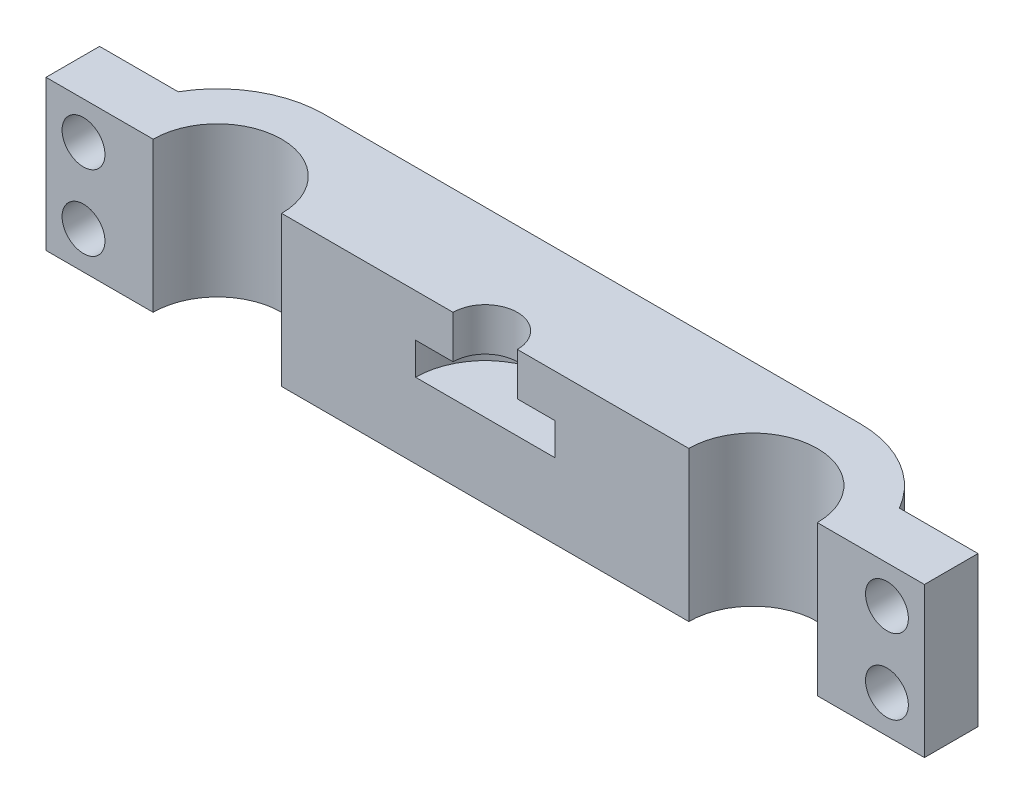
from build123d import *

# Parameters (mm, degrees)
BOSS_EXTRUDE1_DEPTH     = 14
CUT_EXTRUDE1_DEPTH      = 45.463468151
CUT_EXTRUDE1_DEPTH_BACK = 45.463468151
SKETCH4_R               = 2
SKETCH5_W               = 9.30871577
SKETCH5_H               = 4.044371358
BOSS_EXTRUDE2_DEPTH     = 7
CUT_EXTRUDE2_START      = 1.5
SKETCH6_R               = 6.5
CUT_EXTRUDE2_DEPTH      = 1.5


with BuildPart() as part:
    # Sketch2 → Boss-Extrude1 (new body)
    with BuildSketch(Plane(origin=(0, 0, 0), x_dir=(1, 0, 0), z_dir=(0, 1, 0))):
        with BuildLine():
            Line((-3, 0), (-19, 0))
            ThreePointArc((-19, 0), (-25, 6), (-31, 0))
            Line((-31, 0), (-41, 0))
            Line((-41, 0), (-41, 5))
            Line((-41, 5), (-33.660254038, 5))
            ThreePointArc((-33.660254038, 5), (-30, 8.660254038), (-25, 10))
            Line((-25, 10), (25, 10))
            ThreePointArc((25, 10), (30, 8.660254038), (33.660254038, 5))
            Line((33.660254038, 5), (41, 5))
            Line((41, 5), (41, 0))
            Line((41, 0), (31, 0))
            ThreePointArc((31, 0), (25, 6), (19, 0))
            Line((19, 0), (3, 0))
            ThreePointArc((3, 0), (0, 3), (-3, 0))
        make_face()
    extrude(amount=BOSS_EXTRUDE1_DEPTH)

    # Sketch4 → Cut-Extrude1 (cut, two sides: drawn at the far end of the back side and taken through both)
    with BuildSketch(Plane.XY.offset(-CUT_EXTRUDE1_DEPTH_BACK)):
        with Locations((-37.5, 10.5)):
            Circle(SKETCH4_R)
        with Locations((-37.5, 3.5)):
            Circle(SKETCH4_R)
        with Locations((37.5, 10.5)):
            Circle(SKETCH4_R)
        with Locations((37.5, 3.5)):
            Circle(SKETCH4_R)
    extrude(amount=CUT_EXTRUDE1_DEPTH + CUT_EXTRUDE1_DEPTH_BACK, mode=Mode.SUBTRACT)

    # Sketch5 → Boss-Extrude2 (add)
    with BuildSketch(Plane.XZ):
        with Locations((-0.028958253, -2.022185679)):
            Rectangle(SKETCH5_W, SKETCH5_H)
    extrude(amount=-BOSS_EXTRUDE2_DEPTH)

    # Sketch6 → Cut-Extrude2 (cut, symmetric)
    with BuildSketch(Plane(origin=(0, 7, 0), x_dir=(1, 0, 0), z_dir=(0, 1, 0)).offset(CUT_EXTRUDE2_START)):
        Circle(SKETCH6_R)
    extrude(amount=CUT_EXTRUDE2_DEPTH, both=True, mode=Mode.SUBTRACT)


solid = part.part
